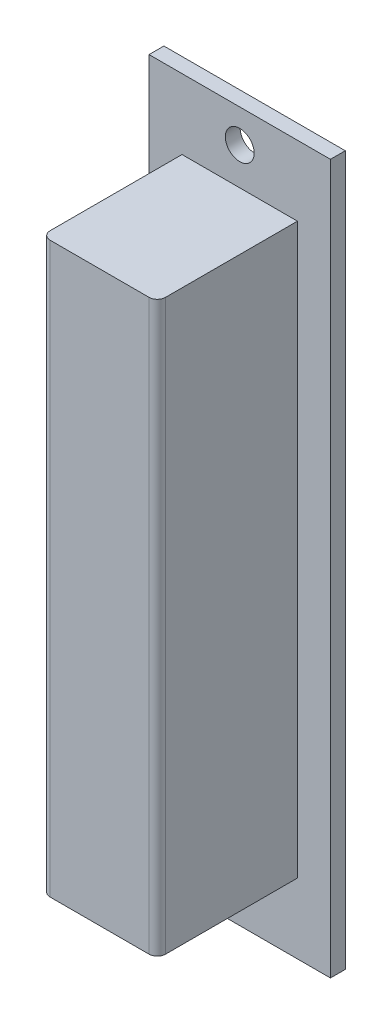
from build123d import *

# Parameters (mm, degrees)
SKETCH_1_W      = 22
SKETCH_1_H      = 86
SKETCH_1_R      = 1.75
EXTRUDE_1_DEPTH = 1.8
SKETCH_2_W      = 14
SKETCH_2_H      = 69
EXTRUDE_2_DEPTH = 17
FILLET_1_R      = 1


with BuildPart() as part:
    # 草图1 → 拉伸1 (new body)
    with BuildSketch(Plane.XY):
        Rectangle(SKETCH_1_W, SKETCH_1_H)
        with Locations((0, 39)):
            Circle(SKETCH_1_R, mode=Mode.SUBTRACT)
        with Locations(Location((0, -39, 0), (0, 0, 180))):
            Circle(SKETCH_1_R, mode=Mode.SUBTRACT)
    extrude(amount=EXTRUDE_1_DEPTH)

    # 草图2 → 拉伸2 (add)
    with BuildSketch(Plane.XY.offset(1.8)):
        Rectangle(SKETCH_2_W, SKETCH_2_H)
    extrude(amount=EXTRUDE_2_DEPTH)

    # 圆角1
    fillet_1_edges = [part.edges().sort_by_distance(p)[0] for p in [
        (-7, 0, 18.8),
        (7, 0, 18.8),
    ]]
    fillet(fillet_1_edges, radius=FILLET_1_R)


solid = part.part
